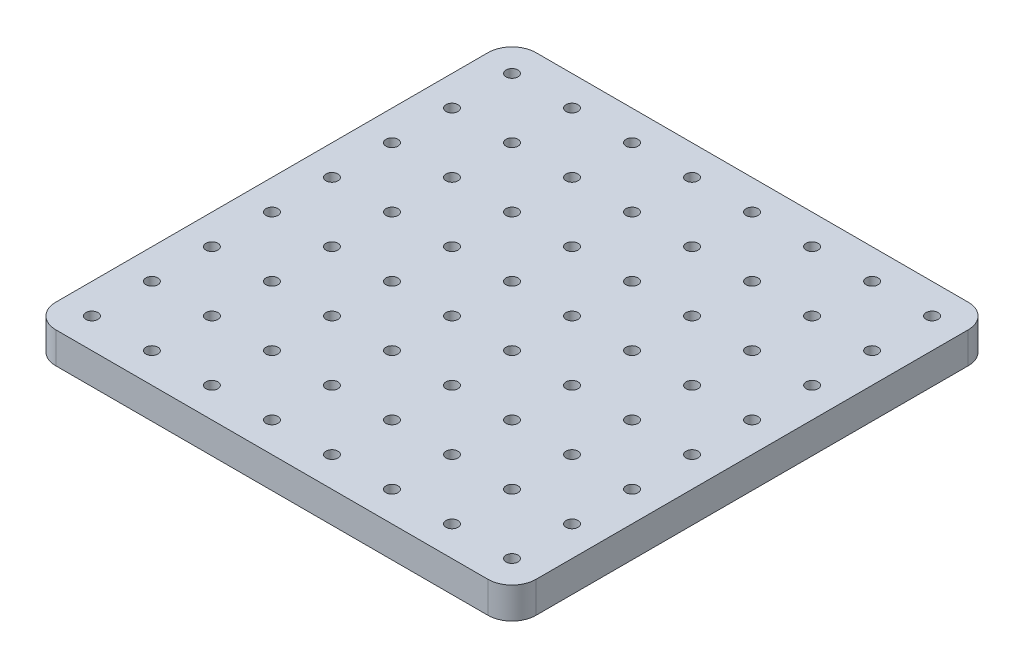
from build123d import *

# Parameters (mm, degrees)
SKETCH1_W                  = 200
SKETCH1_H                  = 200
BOSS_EXTRUDE1_DEPTH        = 13
SKETCH2_R                  = 2.5
CUT_EXTRUDE2_DEPTH         = 13
LPATTERN1_COUNT            = 8
LPATTERN1_PITCH            = 25
LPATTERN2_COUNT            = 8
LPATTERN2_PITCH            = 25
LPATTERN2_COPY_1_SKETCH_R  = 2.5
LPATTERN2_COPY_1_DEPTH     = 13
LPATTERN2_COPY_2_SKETCH_R  = 2.5
LPATTERN2_COPY_2_DEPTH     = 13
LPATTERN2_COPY_3_SKETCH_R  = 2.5
LPATTERN2_COPY_3_DEPTH     = 13
LPATTERN2_COPY_4_SKETCH_R  = 2.5
LPATTERN2_COPY_4_DEPTH     = 13
LPATTERN2_COPY_5_SKETCH_R  = 2.5
LPATTERN2_COPY_5_DEPTH     = 13
LPATTERN2_COPY_6_SKETCH_R  = 2.5
LPATTERN2_COPY_6_DEPTH     = 13
LPATTERN2_COPY_7_SKETCH_R  = 2.5
LPATTERN2_COPY_7_DEPTH     = 13
LPATTERN2_COPY_8_SKETCH_R  = 2.5
LPATTERN2_COPY_8_DEPTH     = 13
LPATTERN2_COPY_9_SKETCH_R  = 2.5
LPATTERN2_COPY_9_DEPTH     = 13
LPATTERN2_COPY_10_SKETCH_R = 2.5
LPATTERN2_COPY_10_DEPTH    = 13
LPATTERN2_COPY_11_SKETCH_R = 2.5
LPATTERN2_COPY_11_DEPTH    = 13
LPATTERN2_COPY_12_SKETCH_R = 2.5
LPATTERN2_COPY_12_DEPTH    = 13
LPATTERN2_COPY_13_SKETCH_R = 2.5
LPATTERN2_COPY_13_DEPTH    = 13
LPATTERN2_COPY_14_SKETCH_R = 2.5
LPATTERN2_COPY_14_DEPTH    = 13
LPATTERN2_COPY_15_SKETCH_R = 2.5
LPATTERN2_COPY_15_DEPTH    = 13
LPATTERN2_COPY_16_SKETCH_R = 2.5
LPATTERN2_COPY_16_DEPTH    = 13
LPATTERN2_COPY_17_SKETCH_R = 2.5
LPATTERN2_COPY_17_DEPTH    = 13
LPATTERN2_COPY_18_SKETCH_R = 2.5
LPATTERN2_COPY_18_DEPTH    = 13
LPATTERN2_COPY_19_SKETCH_R = 2.5
LPATTERN2_COPY_19_DEPTH    = 13
LPATTERN2_COPY_20_SKETCH_R = 2.5
LPATTERN2_COPY_20_DEPTH    = 13
LPATTERN2_COPY_21_SKETCH_R = 2.5
LPATTERN2_COPY_21_DEPTH    = 13
LPATTERN2_COPY_22_SKETCH_R = 2.5
LPATTERN2_COPY_22_DEPTH    = 13
LPATTERN2_COPY_23_SKETCH_R = 2.5
LPATTERN2_COPY_23_DEPTH    = 13
LPATTERN2_COPY_24_SKETCH_R = 2.5
LPATTERN2_COPY_24_DEPTH    = 13
LPATTERN2_COPY_25_SKETCH_R = 2.5
LPATTERN2_COPY_25_DEPTH    = 13
LPATTERN2_COPY_26_SKETCH_R = 2.5
LPATTERN2_COPY_26_DEPTH    = 13
LPATTERN2_COPY_27_SKETCH_R = 2.5
LPATTERN2_COPY_27_DEPTH    = 13
LPATTERN2_COPY_28_SKETCH_R = 2.5
LPATTERN2_COPY_28_DEPTH    = 13
LPATTERN2_COPY_29_SKETCH_R = 2.5
LPATTERN2_COPY_29_DEPTH    = 13
LPATTERN2_COPY_30_SKETCH_R = 2.5
LPATTERN2_COPY_30_DEPTH    = 13
LPATTERN2_COPY_31_SKETCH_R = 2.5
LPATTERN2_COPY_31_DEPTH    = 13
LPATTERN2_COPY_32_SKETCH_R = 2.5
LPATTERN2_COPY_32_DEPTH    = 13
LPATTERN2_COPY_33_SKETCH_R = 2.5
LPATTERN2_COPY_33_DEPTH    = 13
LPATTERN2_COPY_34_SKETCH_R = 2.5
LPATTERN2_COPY_34_DEPTH    = 13
LPATTERN2_COPY_35_SKETCH_R = 2.5
LPATTERN2_COPY_35_DEPTH    = 13
LPATTERN2_COPY_36_SKETCH_R = 2.5
LPATTERN2_COPY_36_DEPTH    = 13
LPATTERN2_COPY_37_SKETCH_R = 2.5
LPATTERN2_COPY_37_DEPTH    = 13
LPATTERN2_COPY_38_SKETCH_R = 2.5
LPATTERN2_COPY_38_DEPTH    = 13
LPATTERN2_COPY_39_SKETCH_R = 2.5
LPATTERN2_COPY_39_DEPTH    = 13
LPATTERN2_COPY_40_SKETCH_R = 2.5
LPATTERN2_COPY_40_DEPTH    = 13
LPATTERN2_COPY_41_SKETCH_R = 2.5
LPATTERN2_COPY_41_DEPTH    = 13
LPATTERN2_COPY_42_SKETCH_R = 2.5
LPATTERN2_COPY_42_DEPTH    = 13
LPATTERN2_COPY_43_SKETCH_R = 2.5
LPATTERN2_COPY_43_DEPTH    = 13
LPATTERN2_COPY_44_SKETCH_R = 2.5
LPATTERN2_COPY_44_DEPTH    = 13
LPATTERN2_COPY_45_SKETCH_R = 2.5
LPATTERN2_COPY_45_DEPTH    = 13
LPATTERN2_COPY_46_SKETCH_R = 2.5
LPATTERN2_COPY_46_DEPTH    = 13
LPATTERN2_COPY_47_SKETCH_R = 2.5
LPATTERN2_COPY_47_DEPTH    = 13
LPATTERN2_COPY_48_SKETCH_R = 2.5
LPATTERN2_COPY_48_DEPTH    = 13
LPATTERN2_COPY_49_SKETCH_R = 2.5
LPATTERN2_COPY_49_DEPTH    = 13
FILLET1_R                  = 10


with BuildPart() as part:
    # Sketch1 → Boss-Extrude1 (new body)
    with BuildSketch(Plane(origin=(0, 0, 0), x_dir=(1, 0, 0), z_dir=(0, 1, 0))):
        with Locations((100, 100)):
            Rectangle(SKETCH1_W, SKETCH1_H)
    extrude(amount=BOSS_EXTRUDE1_DEPTH)

    # Sketch2 → Cut-Extrude2 (cut)
    with BuildSketch(Plane(origin=(0, 13, 0), x_dir=(1, 0, 0), z_dir=(0, 1, 0))):
        with Locations(Location((12.5, 12.5, 0), (0, 0, 270))):
            Circle(SKETCH2_R)
    cut_extrude2 = extrude(amount=-CUT_EXTRUDE2_DEPTH, mode=Mode.SUBTRACT)

    # LPattern1: Cut-Extrude2 ×8
    with Locations(*[(i * LPATTERN1_PITCH, 0, 0) for i in range(1, LPATTERN1_COUNT)]):
        add(cut_extrude2, mode=Mode.SUBTRACT)

    # LPattern2: Cut-Extrude2 ×8
    with Locations(*[(0, 0, -i * LPATTERN2_PITCH) for i in range(1, LPATTERN2_COUNT)]):
        add(cut_extrude2, mode=Mode.SUBTRACT)

    # LPattern2 copy 1 sketch → LPattern2 copy 1 (cut)
    with BuildSketch(Plane(origin=(25, 13, -25), x_dir=(1, 0, 0), z_dir=(0, 1, 0))):
        with Locations(Location((12.5, 12.5, 0), (0, 0, 270))):
            Circle(LPATTERN2_COPY_1_SKETCH_R)
    extrude(amount=-LPATTERN2_COPY_1_DEPTH, mode=Mode.SUBTRACT)

    # LPattern2 copy 2 sketch → LPattern2 copy 2 (cut)
    with BuildSketch(Plane(origin=(25, 13, -50), x_dir=(1, 0, 0), z_dir=(0, 1, 0))):
        with Locations(Location((12.5, 12.5, 0), (0, 0, 270))):
            Circle(LPATTERN2_COPY_2_SKETCH_R)
    extrude(amount=-LPATTERN2_COPY_2_DEPTH, mode=Mode.SUBTRACT)

    # LPattern2 copy 3 sketch → LPattern2 copy 3 (cut)
    with BuildSketch(Plane(origin=(25, 13, -75), x_dir=(1, 0, 0), z_dir=(0, 1, 0))):
        with Locations(Location((12.5, 12.5, 0), (0, 0, 270))):
            Circle(LPATTERN2_COPY_3_SKETCH_R)
    extrude(amount=-LPATTERN2_COPY_3_DEPTH, mode=Mode.SUBTRACT)

    # LPattern2 copy 4 sketch → LPattern2 copy 4 (cut)
    with BuildSketch(Plane(origin=(25, 13, -100), x_dir=(1, 0, 0), z_dir=(0, 1, 0))):
        with Locations(Location((12.5, 12.5, 0), (0, 0, 270))):
            Circle(LPATTERN2_COPY_4_SKETCH_R)
    extrude(amount=-LPATTERN2_COPY_4_DEPTH, mode=Mode.SUBTRACT)

    # LPattern2 copy 5 sketch → LPattern2 copy 5 (cut)
    with BuildSketch(Plane(origin=(25, 13, -125), x_dir=(1, 0, 0), z_dir=(0, 1, 0))):
        with Locations(Location((12.5, 12.5, 0), (0, 0, 270))):
            Circle(LPATTERN2_COPY_5_SKETCH_R)
    extrude(amount=-LPATTERN2_COPY_5_DEPTH, mode=Mode.SUBTRACT)

    # LPattern2 copy 6 sketch → LPattern2 copy 6 (cut)
    with BuildSketch(Plane(origin=(25, 13, -150), x_dir=(1, 0, 0), z_dir=(0, 1, 0))):
        with Locations(Location((12.5, 12.5, 0), (0, 0, 270))):
            Circle(LPATTERN2_COPY_6_SKETCH_R)
    extrude(amount=-LPATTERN2_COPY_6_DEPTH, mode=Mode.SUBTRACT)

    # LPattern2 copy 7 sketch → LPattern2 copy 7 (cut)
    with BuildSketch(Plane(origin=(25, 13, -175), x_dir=(1, 0, 0), z_dir=(0, 1, 0))):
        with Locations(Location((12.5, 12.5, 0), (0, 0, 270))):
            Circle(LPATTERN2_COPY_7_SKETCH_R)
    extrude(amount=-LPATTERN2_COPY_7_DEPTH, mode=Mode.SUBTRACT)

    # LPattern2 copy 8 sketch → LPattern2 copy 8 (cut)
    with BuildSketch(Plane(origin=(50, 13, -25), x_dir=(1, 0, 0), z_dir=(0, 1, 0))):
        with Locations(Location((12.5, 12.5, 0), (0, 0, 270))):
            Circle(LPATTERN2_COPY_8_SKETCH_R)
    extrude(amount=-LPATTERN2_COPY_8_DEPTH, mode=Mode.SUBTRACT)

    # LPattern2 copy 9 sketch → LPattern2 copy 9 (cut)
    with BuildSketch(Plane(origin=(50, 13, -50), x_dir=(1, 0, 0), z_dir=(0, 1, 0))):
        with Locations(Location((12.5, 12.5, 0), (0, 0, 270))):
            Circle(LPATTERN2_COPY_9_SKETCH_R)
    extrude(amount=-LPATTERN2_COPY_9_DEPTH, mode=Mode.SUBTRACT)

    # LPattern2 copy 10 sketch → LPattern2 copy 10 (cut)
    with BuildSketch(Plane(origin=(50, 13, -75), x_dir=(1, 0, 0), z_dir=(0, 1, 0))):
        with Locations(Location((12.5, 12.5, 0), (0, 0, 270))):
            Circle(LPATTERN2_COPY_10_SKETCH_R)
    extrude(amount=-LPATTERN2_COPY_10_DEPTH, mode=Mode.SUBTRACT)

    # LPattern2 copy 11 sketch → LPattern2 copy 11 (cut)
    with BuildSketch(Plane(origin=(50, 13, -100), x_dir=(1, 0, 0), z_dir=(0, 1, 0))):
        with Locations(Location((12.5, 12.5, 0), (0, 0, 270))):
            Circle(LPATTERN2_COPY_11_SKETCH_R)
    extrude(amount=-LPATTERN2_COPY_11_DEPTH, mode=Mode.SUBTRACT)

    # LPattern2 copy 12 sketch → LPattern2 copy 12 (cut)
    with BuildSketch(Plane(origin=(50, 13, -125), x_dir=(1, 0, 0), z_dir=(0, 1, 0))):
        with Locations(Location((12.5, 12.5, 0), (0, 0, 270))):
            Circle(LPATTERN2_COPY_12_SKETCH_R)
    extrude(amount=-LPATTERN2_COPY_12_DEPTH, mode=Mode.SUBTRACT)

    # LPattern2 copy 13 sketch → LPattern2 copy 13 (cut)
    with BuildSketch(Plane(origin=(50, 13, -150), x_dir=(1, 0, 0), z_dir=(0, 1, 0))):
        with Locations(Location((12.5, 12.5, 0), (0, 0, 270))):
            Circle(LPATTERN2_COPY_13_SKETCH_R)
    extrude(amount=-LPATTERN2_COPY_13_DEPTH, mode=Mode.SUBTRACT)

    # LPattern2 copy 14 sketch → LPattern2 copy 14 (cut)
    with BuildSketch(Plane(origin=(50, 13, -175), x_dir=(1, 0, 0), z_dir=(0, 1, 0))):
        with Locations(Location((12.5, 12.5, 0), (0, 0, 270))):
            Circle(LPATTERN2_COPY_14_SKETCH_R)
    extrude(amount=-LPATTERN2_COPY_14_DEPTH, mode=Mode.SUBTRACT)

    # LPattern2 copy 15 sketch → LPattern2 copy 15 (cut)
    with BuildSketch(Plane(origin=(75, 13, -25), x_dir=(1, 0, 0), z_dir=(0, 1, 0))):
        with Locations(Location((12.5, 12.5, 0), (0, 0, 270))):
            Circle(LPATTERN2_COPY_15_SKETCH_R)
    extrude(amount=-LPATTERN2_COPY_15_DEPTH, mode=Mode.SUBTRACT)

    # LPattern2 copy 16 sketch → LPattern2 copy 16 (cut)
    with BuildSketch(Plane(origin=(75, 13, -50), x_dir=(1, 0, 0), z_dir=(0, 1, 0))):
        with Locations(Location((12.5, 12.5, 0), (0, 0, 270))):
            Circle(LPATTERN2_COPY_16_SKETCH_R)
    extrude(amount=-LPATTERN2_COPY_16_DEPTH, mode=Mode.SUBTRACT)

    # LPattern2 copy 17 sketch → LPattern2 copy 17 (cut)
    with BuildSketch(Plane(origin=(75, 13, -75), x_dir=(1, 0, 0), z_dir=(0, 1, 0))):
        with Locations(Location((12.5, 12.5, 0), (0, 0, 270))):
            Circle(LPATTERN2_COPY_17_SKETCH_R)
    extrude(amount=-LPATTERN2_COPY_17_DEPTH, mode=Mode.SUBTRACT)

    # LPattern2 copy 18 sketch → LPattern2 copy 18 (cut)
    with BuildSketch(Plane(origin=(75, 13, -100), x_dir=(1, 0, 0), z_dir=(0, 1, 0))):
        with Locations(Location((12.5, 12.5, 0), (0, 0, 270))):
            Circle(LPATTERN2_COPY_18_SKETCH_R)
    extrude(amount=-LPATTERN2_COPY_18_DEPTH, mode=Mode.SUBTRACT)

    # LPattern2 copy 19 sketch → LPattern2 copy 19 (cut)
    with BuildSketch(Plane(origin=(75, 13, -125), x_dir=(1, 0, 0), z_dir=(0, 1, 0))):
        with Locations(Location((12.5, 12.5, 0), (0, 0, 270))):
            Circle(LPATTERN2_COPY_19_SKETCH_R)
    extrude(amount=-LPATTERN2_COPY_19_DEPTH, mode=Mode.SUBTRACT)

    # LPattern2 copy 20 sketch → LPattern2 copy 20 (cut)
    with BuildSketch(Plane(origin=(75, 13, -150), x_dir=(1, 0, 0), z_dir=(0, 1, 0))):
        with Locations(Location((12.5, 12.5, 0), (0, 0, 270))):
            Circle(LPATTERN2_COPY_20_SKETCH_R)
    extrude(amount=-LPATTERN2_COPY_20_DEPTH, mode=Mode.SUBTRACT)

    # LPattern2 copy 21 sketch → LPattern2 copy 21 (cut)
    with BuildSketch(Plane(origin=(75, 13, -175), x_dir=(1, 0, 0), z_dir=(0, 1, 0))):
        with Locations(Location((12.5, 12.5, 0), (0, 0, 270))):
            Circle(LPATTERN2_COPY_21_SKETCH_R)
    extrude(amount=-LPATTERN2_COPY_21_DEPTH, mode=Mode.SUBTRACT)

    # LPattern2 copy 22 sketch → LPattern2 copy 22 (cut)
    with BuildSketch(Plane(origin=(100, 13, -25), x_dir=(1, 0, 0), z_dir=(0, 1, 0))):
        with Locations(Location((12.5, 12.5, 0), (0, 0, 270))):
            Circle(LPATTERN2_COPY_22_SKETCH_R)
    extrude(amount=-LPATTERN2_COPY_22_DEPTH, mode=Mode.SUBTRACT)

    # LPattern2 copy 23 sketch → LPattern2 copy 23 (cut)
    with BuildSketch(Plane(origin=(100, 13, -50), x_dir=(1, 0, 0), z_dir=(0, 1, 0))):
        with Locations(Location((12.5, 12.5, 0), (0, 0, 270))):
            Circle(LPATTERN2_COPY_23_SKETCH_R)
    extrude(amount=-LPATTERN2_COPY_23_DEPTH, mode=Mode.SUBTRACT)

    # LPattern2 copy 24 sketch → LPattern2 copy 24 (cut)
    with BuildSketch(Plane(origin=(100, 13, -75), x_dir=(1, 0, 0), z_dir=(0, 1, 0))):
        with Locations(Location((12.5, 12.5, 0), (0, 0, 270))):
            Circle(LPATTERN2_COPY_24_SKETCH_R)
    extrude(amount=-LPATTERN2_COPY_24_DEPTH, mode=Mode.SUBTRACT)

    # LPattern2 copy 25 sketch → LPattern2 copy 25 (cut)
    with BuildSketch(Plane(origin=(100, 13, -100), x_dir=(1, 0, 0), z_dir=(0, 1, 0))):
        with Locations(Location((12.5, 12.5, 0), (0, 0, 270))):
            Circle(LPATTERN2_COPY_25_SKETCH_R)
    extrude(amount=-LPATTERN2_COPY_25_DEPTH, mode=Mode.SUBTRACT)

    # LPattern2 copy 26 sketch → LPattern2 copy 26 (cut)
    with BuildSketch(Plane(origin=(100, 13, -125), x_dir=(1, 0, 0), z_dir=(0, 1, 0))):
        with Locations(Location((12.5, 12.5, 0), (0, 0, 270))):
            Circle(LPATTERN2_COPY_26_SKETCH_R)
    extrude(amount=-LPATTERN2_COPY_26_DEPTH, mode=Mode.SUBTRACT)

    # LPattern2 copy 27 sketch → LPattern2 copy 27 (cut)
    with BuildSketch(Plane(origin=(100, 13, -150), x_dir=(1, 0, 0), z_dir=(0, 1, 0))):
        with Locations(Location((12.5, 12.5, 0), (0, 0, 270))):
            Circle(LPATTERN2_COPY_27_SKETCH_R)
    extrude(amount=-LPATTERN2_COPY_27_DEPTH, mode=Mode.SUBTRACT)

    # LPattern2 copy 28 sketch → LPattern2 copy 28 (cut)
    with BuildSketch(Plane(origin=(100, 13, -175), x_dir=(1, 0, 0), z_dir=(0, 1, 0))):
        with Locations(Location((12.5, 12.5, 0), (0, 0, 270))):
            Circle(LPATTERN2_COPY_28_SKETCH_R)
    extrude(amount=-LPATTERN2_COPY_28_DEPTH, mode=Mode.SUBTRACT)

    # LPattern2 copy 29 sketch → LPattern2 copy 29 (cut)
    with BuildSketch(Plane(origin=(125, 13, -25), x_dir=(1, 0, 0), z_dir=(0, 1, 0))):
        with Locations(Location((12.5, 12.5, 0), (0, 0, 270))):
            Circle(LPATTERN2_COPY_29_SKETCH_R)
    extrude(amount=-LPATTERN2_COPY_29_DEPTH, mode=Mode.SUBTRACT)

    # LPattern2 copy 30 sketch → LPattern2 copy 30 (cut)
    with BuildSketch(Plane(origin=(125, 13, -50), x_dir=(1, 0, 0), z_dir=(0, 1, 0))):
        with Locations(Location((12.5, 12.5, 0), (0, 0, 270))):
            Circle(LPATTERN2_COPY_30_SKETCH_R)
    extrude(amount=-LPATTERN2_COPY_30_DEPTH, mode=Mode.SUBTRACT)

    # LPattern2 copy 31 sketch → LPattern2 copy 31 (cut)
    with BuildSketch(Plane(origin=(125, 13, -75), x_dir=(1, 0, 0), z_dir=(0, 1, 0))):
        with Locations(Location((12.5, 12.5, 0), (0, 0, 270))):
            Circle(LPATTERN2_COPY_31_SKETCH_R)
    extrude(amount=-LPATTERN2_COPY_31_DEPTH, mode=Mode.SUBTRACT)

    # LPattern2 copy 32 sketch → LPattern2 copy 32 (cut)
    with BuildSketch(Plane(origin=(125, 13, -100), x_dir=(1, 0, 0), z_dir=(0, 1, 0))):
        with Locations(Location((12.5, 12.5, 0), (0, 0, 270))):
            Circle(LPATTERN2_COPY_32_SKETCH_R)
    extrude(amount=-LPATTERN2_COPY_32_DEPTH, mode=Mode.SUBTRACT)

    # LPattern2 copy 33 sketch → LPattern2 copy 33 (cut)
    with BuildSketch(Plane(origin=(125, 13, -125), x_dir=(1, 0, 0), z_dir=(0, 1, 0))):
        with Locations(Location((12.5, 12.5, 0), (0, 0, 270))):
            Circle(LPATTERN2_COPY_33_SKETCH_R)
    extrude(amount=-LPATTERN2_COPY_33_DEPTH, mode=Mode.SUBTRACT)

    # LPattern2 copy 34 sketch → LPattern2 copy 34 (cut)
    with BuildSketch(Plane(origin=(125, 13, -150), x_dir=(1, 0, 0), z_dir=(0, 1, 0))):
        with Locations(Location((12.5, 12.5, 0), (0, 0, 270))):
            Circle(LPATTERN2_COPY_34_SKETCH_R)
    extrude(amount=-LPATTERN2_COPY_34_DEPTH, mode=Mode.SUBTRACT)

    # LPattern2 copy 35 sketch → LPattern2 copy 35 (cut)
    with BuildSketch(Plane(origin=(125, 13, -175), x_dir=(1, 0, 0), z_dir=(0, 1, 0))):
        with Locations(Location((12.5, 12.5, 0), (0, 0, 270))):
            Circle(LPATTERN2_COPY_35_SKETCH_R)
    extrude(amount=-LPATTERN2_COPY_35_DEPTH, mode=Mode.SUBTRACT)

    # LPattern2 copy 36 sketch → LPattern2 copy 36 (cut)
    with BuildSketch(Plane(origin=(150, 13, -25), x_dir=(1, 0, 0), z_dir=(0, 1, 0))):
        with Locations(Location((12.5, 12.5, 0), (0, 0, 270))):
            Circle(LPATTERN2_COPY_36_SKETCH_R)
    extrude(amount=-LPATTERN2_COPY_36_DEPTH, mode=Mode.SUBTRACT)

    # LPattern2 copy 37 sketch → LPattern2 copy 37 (cut)
    with BuildSketch(Plane(origin=(150, 13, -50), x_dir=(1, 0, 0), z_dir=(0, 1, 0))):
        with Locations(Location((12.5, 12.5, 0), (0, 0, 270))):
            Circle(LPATTERN2_COPY_37_SKETCH_R)
    extrude(amount=-LPATTERN2_COPY_37_DEPTH, mode=Mode.SUBTRACT)

    # LPattern2 copy 38 sketch → LPattern2 copy 38 (cut)
    with BuildSketch(Plane(origin=(150, 13, -75), x_dir=(1, 0, 0), z_dir=(0, 1, 0))):
        with Locations(Location((12.5, 12.5, 0), (0, 0, 270))):
            Circle(LPATTERN2_COPY_38_SKETCH_R)
    extrude(amount=-LPATTERN2_COPY_38_DEPTH, mode=Mode.SUBTRACT)

    # LPattern2 copy 39 sketch → LPattern2 copy 39 (cut)
    with BuildSketch(Plane(origin=(150, 13, -100), x_dir=(1, 0, 0), z_dir=(0, 1, 0))):
        with Locations(Location((12.5, 12.5, 0), (0, 0, 270))):
            Circle(LPATTERN2_COPY_39_SKETCH_R)
    extrude(amount=-LPATTERN2_COPY_39_DEPTH, mode=Mode.SUBTRACT)

    # LPattern2 copy 40 sketch → LPattern2 copy 40 (cut)
    with BuildSketch(Plane(origin=(150, 13, -125), x_dir=(1, 0, 0), z_dir=(0, 1, 0))):
        with Locations(Location((12.5, 12.5, 0), (0, 0, 270))):
            Circle(LPATTERN2_COPY_40_SKETCH_R)
    extrude(amount=-LPATTERN2_COPY_40_DEPTH, mode=Mode.SUBTRACT)

    # LPattern2 copy 41 sketch → LPattern2 copy 41 (cut)
    with BuildSketch(Plane(origin=(150, 13, -150), x_dir=(1, 0, 0), z_dir=(0, 1, 0))):
        with Locations(Location((12.5, 12.5, 0), (0, 0, 270))):
            Circle(LPATTERN2_COPY_41_SKETCH_R)
    extrude(amount=-LPATTERN2_COPY_41_DEPTH, mode=Mode.SUBTRACT)

    # LPattern2 copy 42 sketch → LPattern2 copy 42 (cut)
    with BuildSketch(Plane(origin=(150, 13, -175), x_dir=(1, 0, 0), z_dir=(0, 1, 0))):
        with Locations(Location((12.5, 12.5, 0), (0, 0, 270))):
            Circle(LPATTERN2_COPY_42_SKETCH_R)
    extrude(amount=-LPATTERN2_COPY_42_DEPTH, mode=Mode.SUBTRACT)

    # LPattern2 copy 43 sketch → LPattern2 copy 43 (cut)
    with BuildSketch(Plane(origin=(175, 13, -25), x_dir=(1, 0, 0), z_dir=(0, 1, 0))):
        with Locations(Location((12.5, 12.5, 0), (0, 0, 270))):
            Circle(LPATTERN2_COPY_43_SKETCH_R)
    extrude(amount=-LPATTERN2_COPY_43_DEPTH, mode=Mode.SUBTRACT)

    # LPattern2 copy 44 sketch → LPattern2 copy 44 (cut)
    with BuildSketch(Plane(origin=(175, 13, -50), x_dir=(1, 0, 0), z_dir=(0, 1, 0))):
        with Locations(Location((12.5, 12.5, 0), (0, 0, 270))):
            Circle(LPATTERN2_COPY_44_SKETCH_R)
    extrude(amount=-LPATTERN2_COPY_44_DEPTH, mode=Mode.SUBTRACT)

    # LPattern2 copy 45 sketch → LPattern2 copy 45 (cut)
    with BuildSketch(Plane(origin=(175, 13, -75), x_dir=(1, 0, 0), z_dir=(0, 1, 0))):
        with Locations(Location((12.5, 12.5, 0), (0, 0, 270))):
            Circle(LPATTERN2_COPY_45_SKETCH_R)
    extrude(amount=-LPATTERN2_COPY_45_DEPTH, mode=Mode.SUBTRACT)

    # LPattern2 copy 46 sketch → LPattern2 copy 46 (cut)
    with BuildSketch(Plane(origin=(175, 13, -100), x_dir=(1, 0, 0), z_dir=(0, 1, 0))):
        with Locations(Location((12.5, 12.5, 0), (0, 0, 270))):
            Circle(LPATTERN2_COPY_46_SKETCH_R)
    extrude(amount=-LPATTERN2_COPY_46_DEPTH, mode=Mode.SUBTRACT)

    # LPattern2 copy 47 sketch → LPattern2 copy 47 (cut)
    with BuildSketch(Plane(origin=(175, 13, -125), x_dir=(1, 0, 0), z_dir=(0, 1, 0))):
        with Locations(Location((12.5, 12.5, 0), (0, 0, 270))):
            Circle(LPATTERN2_COPY_47_SKETCH_R)
    extrude(amount=-LPATTERN2_COPY_47_DEPTH, mode=Mode.SUBTRACT)

    # LPattern2 copy 48 sketch → LPattern2 copy 48 (cut)
    with BuildSketch(Plane(origin=(175, 13, -150), x_dir=(1, 0, 0), z_dir=(0, 1, 0))):
        with Locations(Location((12.5, 12.5, 0), (0, 0, 270))):
            Circle(LPATTERN2_COPY_48_SKETCH_R)
    extrude(amount=-LPATTERN2_COPY_48_DEPTH, mode=Mode.SUBTRACT)

    # LPattern2 copy 49 sketch → LPattern2 copy 49 (cut)
    with BuildSketch(Plane(origin=(175, 13, -175), x_dir=(1, 0, 0), z_dir=(0, 1, 0))):
        with Locations(Location((12.5, 12.5, 0), (0, 0, 270))):
            Circle(LPATTERN2_COPY_49_SKETCH_R)
    extrude(amount=-LPATTERN2_COPY_49_DEPTH, mode=Mode.SUBTRACT)

    # Fillet1
    fillet1_edges = [part.edges().sort_by_distance(p)[0] for p in [
        (0, 6.5, -200),
        (200, 6.5, -200),
        (200, 6.5, 0),
        (0, 6.5, 0),
    ]]
    fillet(fillet1_edges, radius=FILLET1_R)


solid = part.part
